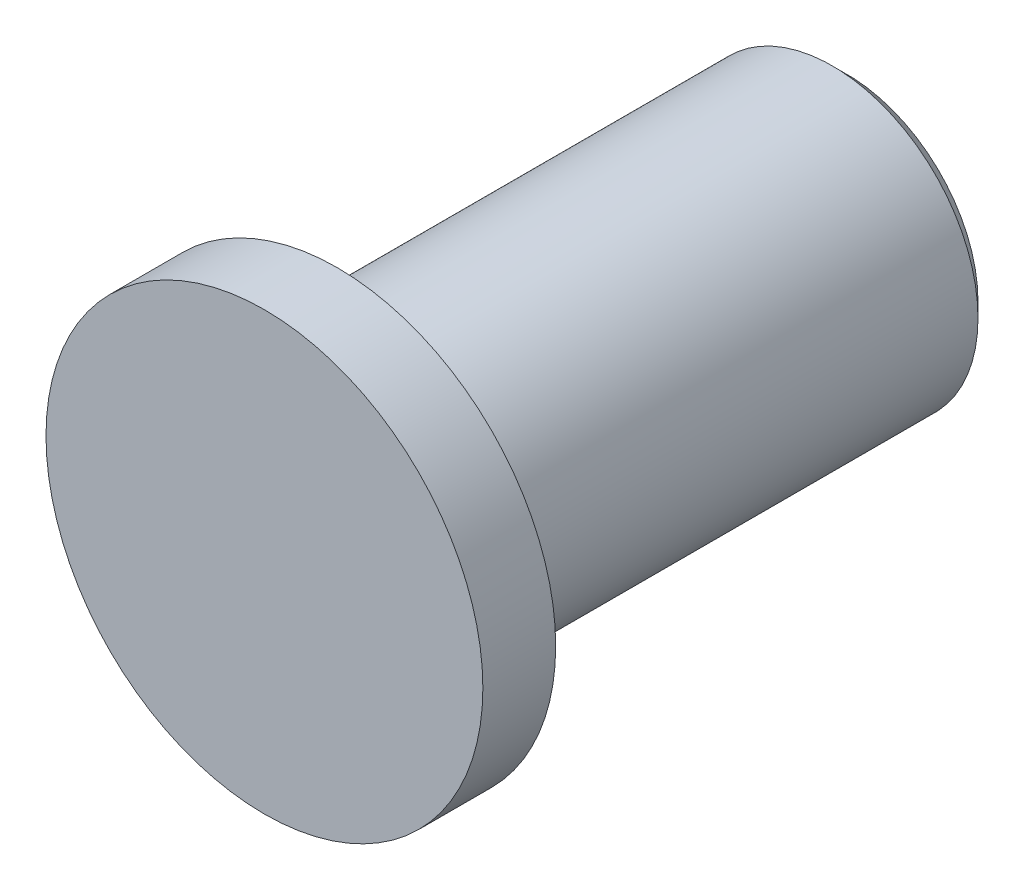
from build123d import *

# Parameters (mm, degrees)
SKETCH1_R           = 10
BOSS_EXTRUDE1_DEPTH = 35
SKETCH2_R           = 15
BOSS_EXTRUDE2_DEPTH = 5
CHAMFER1_SIZE       = 1


with BuildPart() as part:
    # Sketch1 → Boss-Extrude1 (new body)
    with BuildSketch(Plane.XY):
        Circle(SKETCH1_R)
    extrude(amount=-BOSS_EXTRUDE1_DEPTH)

    # Sketch2 → Boss-Extrude2 (add)
    with BuildSketch(Plane.XY):
        Circle(SKETCH2_R)
    extrude(amount=BOSS_EXTRUDE2_DEPTH)

    # Chamfer1
    chamfer1_edges = [part.edges().sort_by_distance(p)[0] for p in [
        (-10, 0, -35),
    ]]
    chamfer(chamfer1_edges, length=CHAMFER1_SIZE)


solid = part.part
